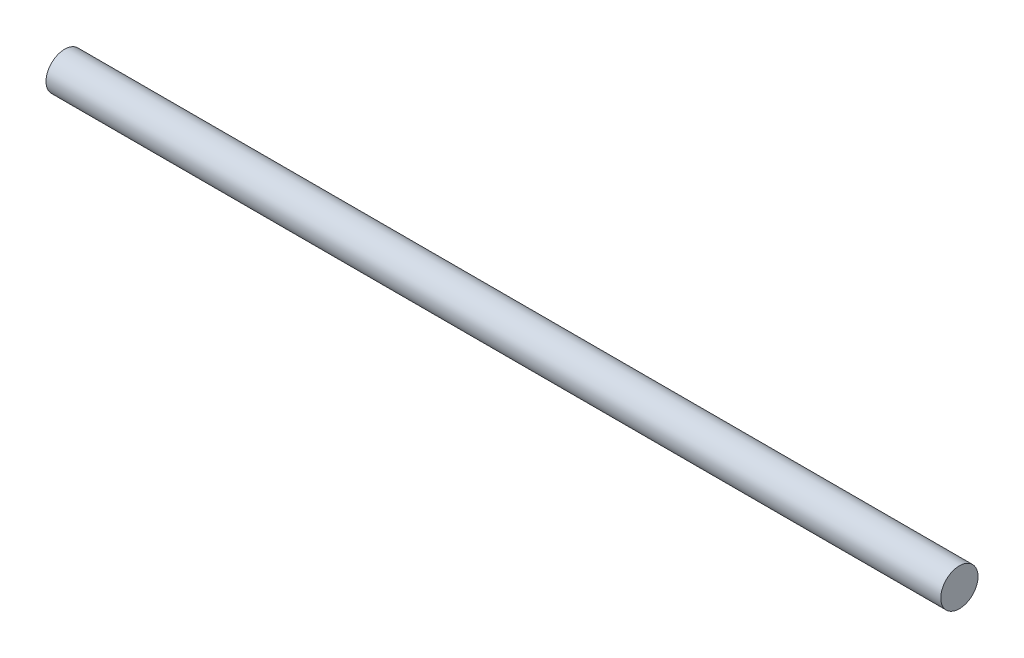
from build123d import *

# Parameters (mm, degrees)
SKETCH2_R           = 3.175
BOSS_EXTRUDE1_DEPTH = 152.4


with BuildPart() as part:
    # Sketch2 → Boss-Extrude1 (new body)
    with BuildSketch(Plane(origin=(0, 0, 0), x_dir=(0, 0, -1), z_dir=(1, 0, 0))):
        with Locations(Location((0, 0, 0), (0, 0, 180))):
            Circle(SKETCH2_R)
    extrude(amount=BOSS_EXTRUDE1_DEPTH)


solid = part.part
